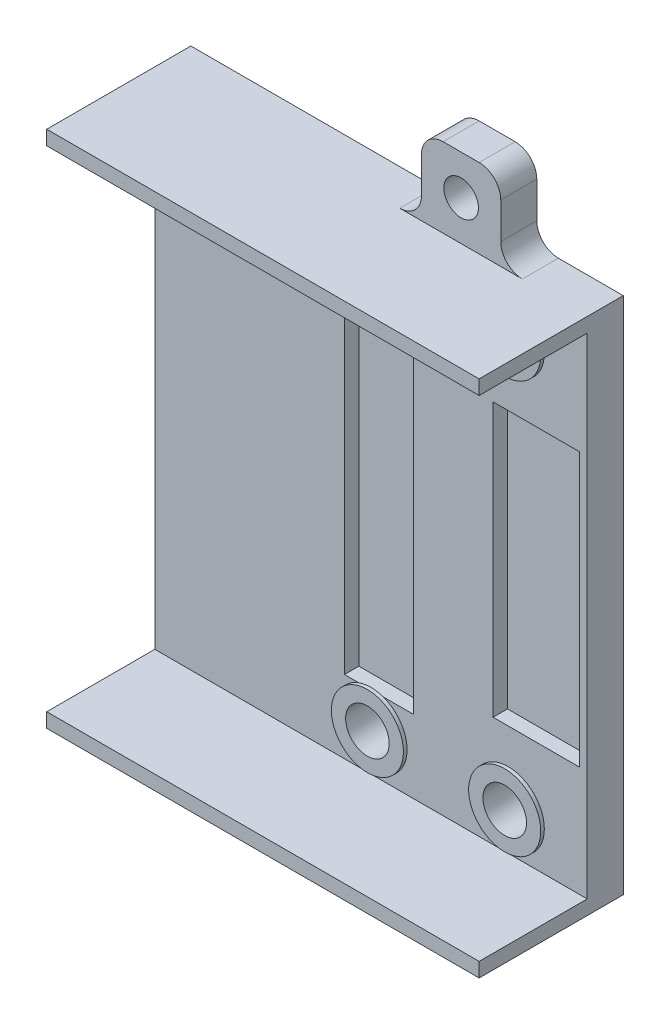
from build123d import *

# Parameters (mm, degrees)
SKETCH3_W            = 60
SKETCH3_H            = 72
BOSS_EXTRUDE1_DEPTH  = 5
SKETCH5_R            = 5
SKETCH5_R_2          = 3.025
BOSS_EXTRUDE2_DEPTH  = 0.5
CUT_EXTRUDE1_START   = -4.5
SKETCH6_R            = 3.025
CUT_EXTRUDE1_DEPTH   = 4.5
SKETCH8_W            = 9.600002072
SKETCH8_H            = 47.399999581
CUT_EXTRUDE2_DEPTH   = 2
SKETCH10_W           = 60
SKETCH10_H           = 2
BOSS_EXTRUDE3_DEPTH  = 15
SKETCH11_W           = 5.5
SKETCH11_H           = 11
BOSS_EXTRUDE4_DEPTH  = 5
M4_CLEARANCE_HOLE1_D = 4.8
FILLET2_R            = 3


with BuildPart() as part:
    # Sketch3 → Boss-Extrude1 (new body)
    with BuildSketch(Plane.XY):
        Rectangle(SKETCH3_W, SKETCH3_H)
    extrude(amount=BOSS_EXTRUDE1_DEPTH)

    # Sketch5 → Boss-Extrude2 (add)
    # profile 1 of 4: a face of its own
    with BuildSketch(Plane.XY.offset(5)):
        with Locations((19.046, 28.575)):
            Circle(SKETCH5_R)
        with Locations((19.046, 28.575)):
            Circle(SKETCH5_R_2, mode=Mode.SUBTRACT)
    # profile 2 of 4: a face of its own
    with BuildSketch(Plane.XY.offset(5)):
        with Locations((19.046, -28.575)):
            Circle(SKETCH5_R)
        with Locations((19.046, -28.575)):
            Circle(SKETCH5_R_2, mode=Mode.SUBTRACT)
    # profile 3 of 4: a face of its own
    with BuildSketch(Plane.XY.offset(5)):
        with Locations((-0.004, -28.575)):
            Circle(SKETCH5_R)
        with Locations((-0.004, -28.575)):
            Circle(SKETCH5_R_2, mode=Mode.SUBTRACT)
    # profile 4 of 4: a face of its own
    with BuildSketch(Plane.XY.offset(5)):
        with Locations((-0.004, 28.575)):
            Circle(SKETCH5_R)
        with Locations((-0.004, 28.575)):
            Circle(SKETCH5_R_2, mode=Mode.SUBTRACT)
    extrude(amount=BOSS_EXTRUDE2_DEPTH)

    # Sketch6 → Cut-Extrude1 (cut)
    with BuildSketch(Plane.XY.offset(5).offset(CUT_EXTRUDE1_START)):
        with Locations((-0.004, 28.575)):
            Circle(SKETCH6_R)
        with Locations((19.046, 28.575)):
            Circle(SKETCH6_R)
        with Locations((-0.004, -28.575)):
            Circle(SKETCH6_R)
        with Locations((19.046, -28.575)):
            Circle(SKETCH6_R)
    extrude(amount=CUT_EXTRUDE1_DEPTH, mode=Mode.SUBTRACT)

    # Sketch8 → Cut-Extrude2 (cut)
    with BuildSketch(Plane.XY.offset(5)):
        with Locations((1.109998413, -0.172003205)):
            Rectangle(SKETCH8_W, SKETCH8_H)
        Polygon((16.933001492, 19.203997676), (28.933001492, 19.203997676), (28.933001492, -18.696002324), (16.933003148, -18.696002324), align=None)
    extrude(amount=-CUT_EXTRUDE2_DEPTH, mode=Mode.SUBTRACT)

    # Sketch10 → Boss-Extrude3 (add)
    with BuildSketch(Plane.XY.offset(5)):
        with Locations((0, 35)):
            Rectangle(SKETCH10_W, SKETCH10_H)
        with Locations((0, -35)):
            Rectangle(SKETCH10_W, SKETCH10_H)
    extrude(amount=BOSS_EXTRUDE3_DEPTH)

    # Sketch11 → Boss-Extrude4 (add)
    with BuildSketch(Plane(origin=(0, 0, 0), x_dir=(-1, 0, 0), z_dir=(0, 0, -1))):
        with Locations((-15.25, 41.5)):
            Rectangle(SKETCH11_W, SKETCH11_H)
        with Locations((-9.75, 41.5)):
            Rectangle(SKETCH11_W, SKETCH11_H)
    boss_extrude4 = extrude(amount=-BOSS_EXTRUDE4_DEPTH)

    # M4 Clearance Hole1 (through all)
    with Locations(Plane.XY.offset(5)):
        with Locations((12.5, 41.5)):
            m4_clearance_hole1 = Hole(M4_CLEARANCE_HOLE1_D / 2)

    # Mirror1: Boss-Extrude4, M4 Clearance Hole1 across plane
    add(boss_extrude4.mirror(Plane.ZX))
    add(m4_clearance_hole1.mirror(Plane.ZX), mode=Mode.SUBTRACT)

    # Fillet2
    fillet2_edges = [part.edges().sort_by_distance(p)[0] for p in [
        (7, 36, 2.5),
        (18, 36, 2.5),
        (18, 47, 2.5),
        (7, 47, 2.5),
        (18, -36, 2.5),
        (7, -36, 2.5),
        (7, -47, 2.5),
        (18, -47, 2.5),
    ]]
    fillet(fillet2_edges, radius=FILLET2_R)


solid = part.part
